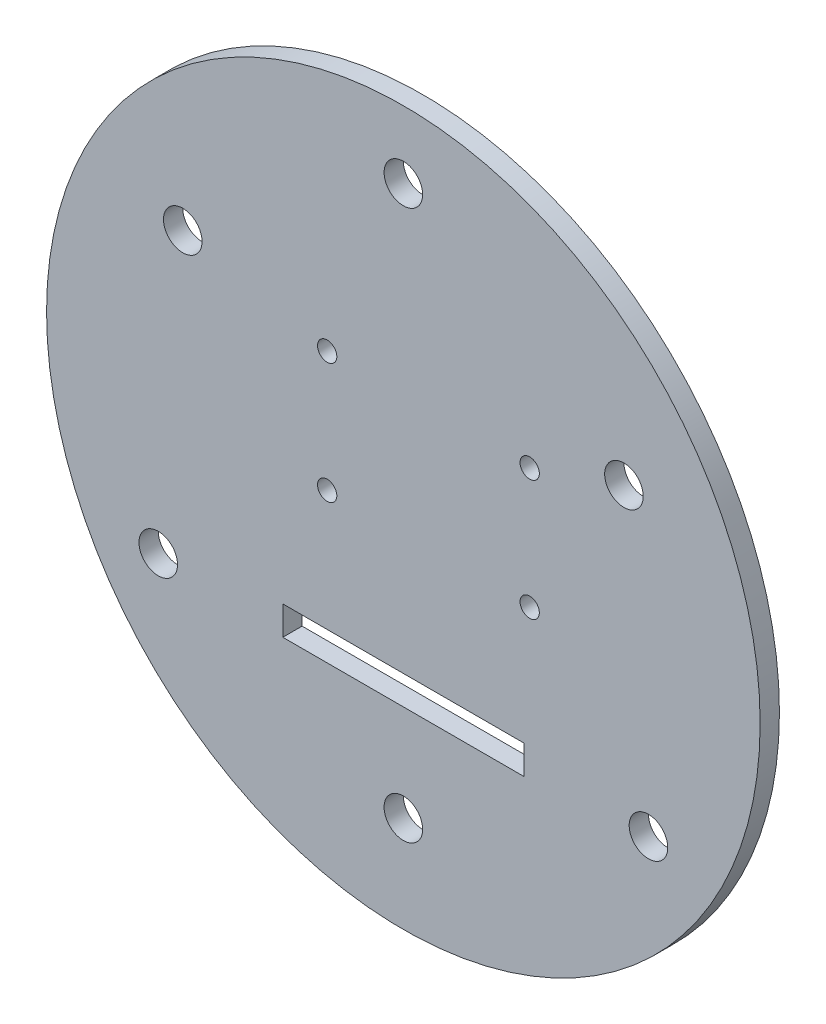
from build123d import *

# Parameters (mm, degrees)
ESQUISSE1_R             = 37
ESQUISSE1_R_2           = 2
ESQUISSE1_W             = 25
ESQUISSE1_H             = 3
BOSS_EXTRU_1_DEPTH      = 2
BOSS_EXTRU_2_DEPTH      = 15
ESQUISSE3_W             = 2
ESQUISSE3_H             = 28.4
BOSS_EXTRU_3_DEPTH      = 2.25
ESQUISSE5_W             = 2
ESQUISSE5_H             = 24.4
BOSS_EXTRU_4_DEPTH      = 2.25
ESQUISSE7_W             = 33.1
ESQUISSE7_H             = 28.4
BOSS_EXTRU_5_DEPTH      = 1
ESQUISSE8_W             = 15
ESQUISSE8_H             = 15
ENL_V_MAT_EXTRU_1_DEPTH = 3
ESQUISSE9_W             = 21
ESQUISSE9_H             = 2.5
ENL_V_MAT_EXTRU_2_DEPTH = 3
ESQUISSE11_W            = 33.1
ESQUISSE11_H            = 28.4
ENL_V_MAT_EXTRU_4_DEPTH = 15
SKETCH1_R               = 1.75
SKETCH1_R_2             = 1
BOSS_EXTRUDE1_DEPTH     = 10
CUT_EXTRUDE1_START      = -10
SKETCH1_3_R             = 1
CUT_EXTRUDE1_DEPTH      = 10


with BuildPart() as part:
    # Esquisse1 → Boss.-Extru.1 (new body)
    with BuildSketch(Plane.XY):
        Circle(ESQUISSE1_R)
        with Locations((0, 30)):
            Circle(ESQUISSE1_R_2, mode=Mode.SUBTRACT)
        with Locations((-22.874807889, 14.34375)):
            Circle(ESQUISSE1_R_2, mode=Mode.SUBTRACT)
        with Locations((-25.416453209, -15.9375)):
            Circle(ESQUISSE1_R_2, mode=Mode.SUBTRACT)
        with Locations((0, -27)):
            Circle(ESQUISSE1_R_2, mode=Mode.SUBTRACT)
        with Locations((25.416453209, -15.9375)):
            Circle(ESQUISSE1_R_2, mode=Mode.SUBTRACT)
        with Locations((22.874807889, 14.34375)):
            Circle(ESQUISSE1_R_2, mode=Mode.SUBTRACT)
        with Locations((0, -15.5)):
            Rectangle(ESQUISSE1_W, ESQUISSE1_H, mode=Mode.SUBTRACT)
    extrude(amount=BOSS_EXTRU_1_DEPTH)

    # Esquisse2 → Boss.-Extru.2 (add)
    with BuildSketch(Plane(origin=(0, 0, 0), x_dir=(-1, 0, 0), z_dir=(0, 0, -1))):
        Polygon((-12.55, 14.9), (-16.55, 14.9), (-16.55, -13.5), (16.55, -13.5), (16.55, 14.9), (12.55, 14.9), (12.55, -9.5), (-12.55, -9.5), align=None)
    extrude(amount=BOSS_EXTRU_2_DEPTH)

    # Esquisse3 → Boss.-Extru.3 (add)
    with BuildSketch(Plane(origin=(-12.55, 0, 0), x_dir=(0, 0, -1), z_dir=(1, 0, 0))):
        with Locations((9.625, 0.7)):
            Rectangle(ESQUISSE3_W, ESQUISSE3_H)
        with Locations((6.625, 0.7)):
            Rectangle(ESQUISSE3_W, ESQUISSE3_H)
    extrude(amount=BOSS_EXTRU_3_DEPTH)

    # Esquisse5 → Boss.-Extru.4 (add)
    with BuildSketch(Plane.ZY.offset(-12.55)):
        with Locations((-9.625, 2.7)):
            Rectangle(ESQUISSE5_W, ESQUISSE5_H)
        with Locations((-6.625, 2.7)):
            Rectangle(ESQUISSE5_W, ESQUISSE5_H)
    extrude(amount=BOSS_EXTRU_4_DEPTH)

    # Esquisse7 → Boss.-Extru.5 (add)
    with BuildSketch(Plane(origin=(0, 0, -15), x_dir=(-1, 0, 0), z_dir=(0, 0, -1))):
        with Locations((0, 0.7)):
            Rectangle(ESQUISSE7_W, ESQUISSE7_H)
    extrude(amount=-BOSS_EXTRU_5_DEPTH)

    # Esquisse8 → Enlèv. mat.-Extru.1 (cut)
    with BuildSketch(Plane(origin=(0, 0, -15), x_dir=(-1, 0, 0), z_dir=(0, 0, -1))):
        Rectangle(ESQUISSE8_W, ESQUISSE8_H)
    extrude(amount=-ENL_V_MAT_EXTRU_1_DEPTH, mode=Mode.SUBTRACT)

    # Esquisse9 → Enlèv. mat.-Extru.2 (cut)
    with BuildSketch(Plane.XZ.offset(13.5)):
        with Locations((0, -5.65)):
            Rectangle(ESQUISSE9_W, ESQUISSE9_H)
    extrude(amount=-ENL_V_MAT_EXTRU_2_DEPTH, mode=Mode.SUBTRACT)

    # Esquisse11 → Enlèv. mat.-Extru.4 (cut)
    with BuildSketch(Plane(origin=(0, 0, -15), x_dir=(-1, 0, 0), z_dir=(0, 0, -1))):
        with Locations((0, 0.7)):
            Rectangle(ESQUISSE11_W, ESQUISSE11_H)
    extrude(amount=-ENL_V_MAT_EXTRU_4_DEPTH, mode=Mode.SUBTRACT)

    # Sketch1 → Boss-Extrude1 (add)
    # profile 1 of 4: a face of its own
    with BuildSketch(Plane(origin=(0, 0, 0), x_dir=(-1, 0, 0), z_dir=(0, 0, -1))):
        with Locations((-13.1, 11)):
            Circle(SKETCH1_R)
        with Locations((-13.1, 11)):
            Circle(SKETCH1_R_2, mode=Mode.SUBTRACT)
    # profile 2 of 4: a face of its own
    with BuildSketch(Plane(origin=(0, 0, 0), x_dir=(-1, 0, 0), z_dir=(0, 0, -1))):
        with Locations((-13.1, -1.5)):
            Circle(SKETCH1_R)
        with Locations((-13.1, -1.5)):
            Circle(SKETCH1_R_2, mode=Mode.SUBTRACT)
    # profile 3 of 4: a face of its own
    with BuildSketch(Plane(origin=(0, 0, 0), x_dir=(-1, 0, 0), z_dir=(0, 0, -1))):
        with Locations((7.9, 11)):
            Circle(SKETCH1_R)
        with Locations((7.9, 11)):
            Circle(SKETCH1_R_2, mode=Mode.SUBTRACT)
    # profile 4 of 4: a face of its own
    with BuildSketch(Plane(origin=(0, 0, 0), x_dir=(-1, 0, 0), z_dir=(0, 0, -1))):
        with Locations((7.9, -1.5)):
            Circle(SKETCH1_R)
        with Locations((7.9, -1.5)):
            Circle(SKETCH1_R_2, mode=Mode.SUBTRACT)
    extrude(amount=BOSS_EXTRUDE1_DEPTH)

    # Sketch1<3> → Cut-Extrude1 (cut)
    with BuildSketch(Plane(origin=(0, 0, 0), x_dir=(-1, 0, 0), z_dir=(0, 0, -1)).offset(CUT_EXTRUDE1_START)):
        with Locations((7.9, -1.5)):
            Circle(SKETCH1_3_R)
        with Locations((-13.1, -1.5)):
            Circle(SKETCH1_3_R)
        with Locations((7.9, 11)):
            Circle(SKETCH1_3_R)
        with Locations((-13.1, 11)):
            Circle(SKETCH1_3_R)
    extrude(amount=CUT_EXTRUDE1_DEPTH, mode=Mode.SUBTRACT)


solid = part.part
